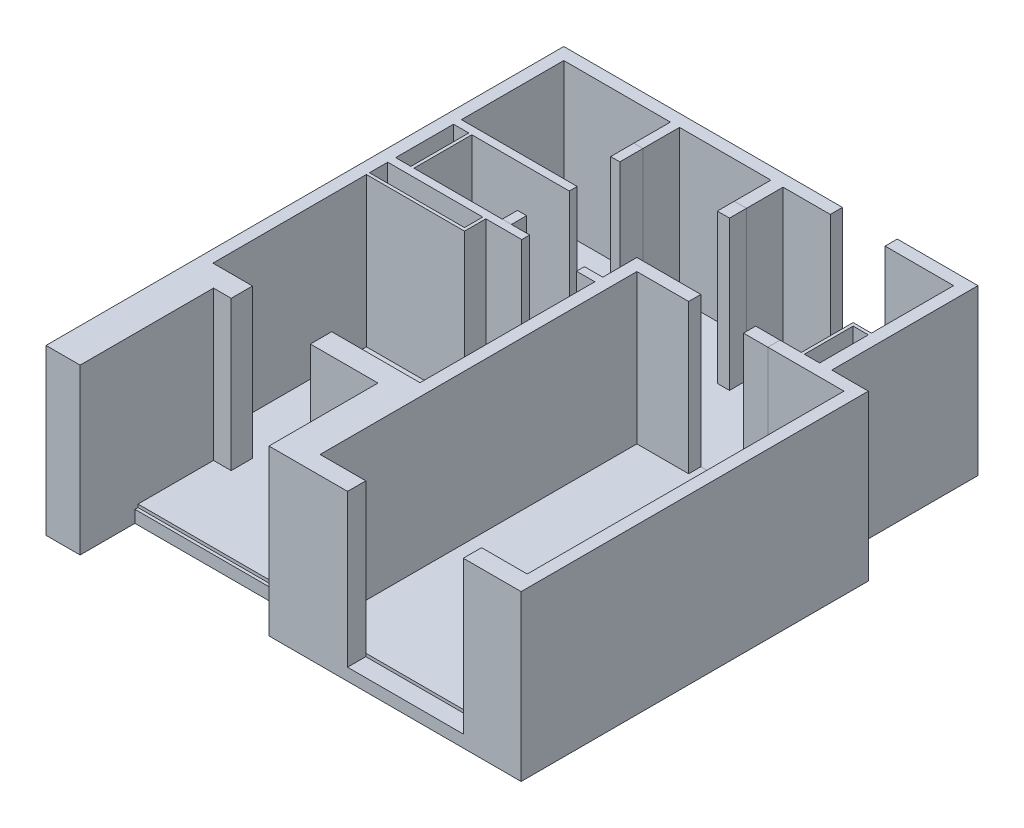
from build123d import *

# Parameters (mm, degrees)
EXTRUDE_2786_DEPTH     = 2500
EXTRUDE_2786_2_DEPTH   = 2500
EXTRUDE_2786_3_DEPTH   = 2500
SKETCH_5_W             = 2200
SKETCH_5_H             = 130
SKETCH_5_W_2           = 300
SKETCH_5_W_3           = 150
SKETCH_5_H_2           = 600
EXTRUDE_3628_DEPTH     = 2500
SKETCH_7_W             = 950
SKETCH_7_H             = 100
EXTRUDE_4552_DEPTH     = 2500
SKETCH_8_W             = 1660
SKETCH_8_H             = 400
SKETCH_8_W_2           = 1560
SKETCH_8_H_2           = 300
EXTRUDE_5124_DEPTH     = 2500
SKETCH_9_W             = 350
SKETCH_9_H             = 900
SKETCH_9_W_2           = 250
SKETCH_9_H_2           = 800
SKETCH_9_H_3           = 1050
SKETCH_9_H_4           = 950
EXTRUDE_5639_DEPTH     = 2500
SKETCH_11_W            = 600
SKETCH_11_H            = 350
EXTRUDE_5921_DEPTH     = 600
EXTRUDE_6398_DEPTH     = 200
SKETCH_13_W            = 150
SKETCH_13_H            = 250
SKETCH_13_H_2          = 380
SKETCH_13_W_2          = 600
SKETCH_13_H_3          = 350
CUT_EXTRUDE_7565_DEPTH = 11480.982578384
SKETCH_14_W            = 400
SKETCH_14_H            = 200
EXTRUDE_7970_DEPTH     = 2500
SKETCH_14_W_2          = 150
SKETCH_14_H_2          = 250
EXTRUDE_7970_2_DEPTH   = 2500
SKETCH_14_H_3          = 380
EXTRUDE_7970_3_DEPTH   = 2500
SKETCH_15_W            = 200
SKETCH_15_H            = 280
EXTRUDE_2_DEPTH        = 2500
EXTRUDE_8866_DEPTH     = 50
EXTRUDE_9266_DEPTH     = 50
EXTRUDE_9553_DEPTH     = 50
EXTRUDE_9789_DEPTH     = 50
SKETCH_45_W            = 80
SKETCH_45_H            = 950
EXTRUDE_33_DEPTH       = 1200
SKETCH_46_W            = 360
SKETCH_46_H            = 360
SKETCH_46_W_2          = 150
SKETCH_46_H_2          = 90
SKETCH_46_W_3          = 200
SKETCH_46_H_3          = 500
CUT_EXTRUDE_2_DEPTH    = 80
EXTRUDE_11227_DEPTH    = 50


with BuildPart() as part:
    # Эскиз3 → Extrude 2786 (new body)
    with BuildSketch(Plane(origin=(0, 0, 0), x_dir=(1, 0, 0), z_dir=(0, 1, 0))):
        Polygon((100, 8300), (3500, 8300), (3500, 7700), (3700, 7700), (3700, 8300), (4475, 8300), (4475, 8500), (-100, 8500), (-100, 0), (100, 0), align=None)
    extrude(amount=EXTRUDE_2786_DEPTH)



with BuildPart() as body_2:
    # Эскиз3 → Extrude 2786 2 (new body)
    with BuildSketch(Plane(origin=(0, 0, 0), x_dir=(1, 0, 0), z_dir=(0, 1, 0))):
        Polygon((6500, 6100), (5850, 6100), (5850, 5900), (7100, 5900), (7100, 700), (6350, 700), (6350, 500), (7300, 500), (7300, 6100), (6700, 6100), (6700, 8500), (5375, 8500), (5375, 8300), (6500, 8300), align=None)
    extrude(amount=EXTRUDE_2786_2_DEPTH)


with BuildPart() as body_3:
    # Эскиз3 → Extrude 2786 3 (new body)
    with BuildSketch(Plane(origin=(0, 0, 0), x_dir=(1, 0, 0), z_dir=(0, 1, 0))):
        Polygon((4450, 700), (3700, 700), (3700, 5900), (4550, 5900), (4550, 6100), (3500, 6100), (3500, 500), (4450, 500), align=None)
    extrude(amount=EXTRUDE_2786_3_DEPTH)


with BuildPart() as part_1:
    add(part.part)

    add(body_3.part)  # Extrude 3628 merges body 3
    # Эскиз5 → Extrude 3628 (add)
    with BuildSketch(Plane(origin=(0, 0, 0), x_dir=(1, 0, 0), z_dir=(0, 1, 0))):
        Polygon((100, 6620), (1850, 6620), (1850, 7000), (2000, 7000), (2000, 6240), (1850, 6240), (1850, 6490), (100, 6490), align=None)
        with Locations((1200, 5475)):
            Rectangle(SKETCH_5_W, SKETCH_5_H)
        with Locations((3350, 5475)):
            Rectangle(SKETCH_5_W_2, SKETCH_5_H)
        with Locations((1925, 8000)):
            Rectangle(SKETCH_5_W_3, SKETCH_5_H_2)
    extrude(amount=EXTRUDE_3628_DEPTH)


    add(body_2.part)  # Extrude 4552 merges body 2
    # Эскиз7 → Extrude 4552 (add)
    with BuildSketch(Plane(origin=(0, 0, 0), x_dir=(1, 0, 0), z_dir=(0, 1, 0))):
        Polygon((750, 2190), (750, 2540), (100, 2540), (100, 0), (460, 0), (460, 2190), align=None)
        Polygon((2050, 2190), (3160, 2190), (3160, 400), (4450, 400), (4450, 500), (3500, 500), (3500, 2540), (2050, 2540), align=None)
        with Locations((6825, 450)):
            Rectangle(SKETCH_7_W, SKETCH_7_H)
    extrude(amount=EXTRUDE_4552_DEPTH)

    # Эскиз8 → Extrude 5124 (add)
    with BuildSketch(Plane(origin=(0, 0, 0), x_dir=(1, 0, 0), z_dir=(0, 1, 0))):
        with Locations((880, 5260)):
            Rectangle(SKETCH_8_W, SKETCH_8_H)
        with Locations((880, 5260)):
            Rectangle(SKETCH_8_W_2, SKETCH_8_H_2, mode=Mode.SUBTRACT)
    extrude(amount=EXTRUDE_5124_DEPTH)

    # Эскиз9 → Extrude 5639 (add)
    # profile 1 of 2: a face of its own
    with BuildSketch(Plane(origin=(0, 0, 0), x_dir=(1, 0, 0), z_dir=(0, 1, 0))):
        with Locations((6375, 6500)):
            Rectangle(SKETCH_9_W, SKETCH_9_H)
        with Locations((6375, 6500)):
            Rectangle(SKETCH_9_W_2, SKETCH_9_H_2, mode=Mode.SUBTRACT)
    # profile 2 of 2: a face of its own
    with BuildSketch(Plane(origin=(0, 0, 0), x_dir=(1, 0, 0), z_dir=(0, 1, 0))):
        with Locations((225, 6015)):
            Rectangle(SKETCH_9_W, SKETCH_9_H_3)
        with Locations((225, 6015)):
            Rectangle(SKETCH_9_W_2, SKETCH_9_H_4, mode=Mode.SUBTRACT)
    extrude(amount=EXTRUDE_5639_DEPTH)

    # Эскиз11 → Extrude 5921 (add)
    with BuildSketch(Plane(origin=(0, 0, 0), x_dir=(1, 0, 0), z_dir=(0, 1, 0))):
        with Locations((1750, 2365)):
            Rectangle(SKETCH_11_W, SKETCH_11_H)
    extrude(amount=EXTRUDE_5921_DEPTH)

    # Эскиз4 → Extrude 6398 (add)
    with BuildSketch(Plane(origin=(0, 0, 0), x_dir=(1, 0, 0), z_dir=(0, 1, 0))):
        Polygon((-100, 8500), (6700, 8500), (6700, 6100), (7300, 6100), (7300, 400), (3160, 400), (3160, 900), (460, 900), (460, 0), (-100, 0), align=None)
    extrude(amount=-EXTRUDE_6398_DEPTH)

    # Эскиз13 → Cut-Extrude 7565 (cut, through all)
    with BuildSketch(Plane(origin=(0, 0, 0), x_dir=(1, 0, 0), z_dir=(0, 1, 0))):
        with Locations((1925, 6365)):
            Rectangle(SKETCH_13_W, SKETCH_13_H)
        with Locations((1925, 6810)):
            Rectangle(SKETCH_13_W, SKETCH_13_H_2)
        with Locations((1750, 2365)):
            Rectangle(SKETCH_13_W_2, SKETCH_13_H_3)
    extrude(amount=CUT_EXTRUDE_7565_DEPTH, mode=Mode.SUBTRACT)


with BuildPart() as body_2_2:
    # Эскиз14 → Extrude 7970 (new, through all)
    with BuildSketch(Plane(origin=(0, 0, 0), x_dir=(1, 0, 0), z_dir=(0, 1, 0))):
        with Locations((5650, 6000)):
            Rectangle(SKETCH_14_W, SKETCH_14_H)
    extrude(amount=EXTRUDE_7970_DEPTH)


with BuildPart() as body_3_2:
    # Эскиз14 → Extrude 7970 2 (new, through all)
    with BuildSketch(Plane(origin=(0, 0, 0), x_dir=(1, 0, 0), z_dir=(0, 1, 0))):
        with Locations((1925, 5665)):
            Rectangle(SKETCH_14_W_2, SKETCH_14_H_2)
    extrude(amount=EXTRUDE_7970_2_DEPTH)


with BuildPart() as body_4:
    # Эскиз14 → Extrude 7970 3 (new, through all)
    with BuildSketch(Plane(origin=(0, 0, 0), x_dir=(1, 0, 0), z_dir=(0, 1, 0))):
        with Locations((1925, 7510)):
            Rectangle(SKETCH_14_W_2, SKETCH_14_H_3)
    extrude(amount=EXTRUDE_7970_3_DEPTH)


with BuildPart() as body_5:
    # Эскиз15 → наращивание стен 2 (new, through all)
    with BuildSketch(Plane(origin=(0, 0, 0), x_dir=(1, 0, 0), z_dir=(0, 1, 0))):
        with Locations((3600, 7560)):
            Rectangle(SKETCH_15_W, SKETCH_15_H)
    extrude(amount=EXTRUDE_2_DEPTH)


with BuildPart() as body_6:
    # Эскиз37 → Extrude 8866 (new body)
    with BuildSketch(Plane(origin=(0, 0, 0), x_dir=(1, 0, 0), z_dir=(0, 1, 0))):
        Polygon((3700, 700), (7100, 700), (7100, 5900), (5850, 5900), (5850, 6100), (4550, 6100), (4550, 5900), (3700, 5900), align=None)
    extrude(amount=EXTRUDE_8866_DEPTH)


with BuildPart() as body_7:
    # Эскиз38 → Extrude 9266 (new body)
    with BuildSketch(Plane(origin=(0, 0, 0), x_dir=(1, 0, 0), z_dir=(0, 1, 0))):
        Polygon((460, 950), (3160, 950), (3160, 2190), (2050, 2190), (2050, 2540), (3500, 2540), (3500, 5410), (3200, 5410), (3200, 5540), (2300, 5540), (2300, 5410), (1710, 5410), (1710, 5060), (100, 5060), (100, 2540), (750, 2540), (750, 2190), (460, 2190), align=None)
    extrude(amount=EXTRUDE_9266_DEPTH)


with BuildPart() as body_8:
    # Эскиз40 → Extrude 9553 (new body)
    with BuildSketch(Plane(origin=(0, 0, 0), x_dir=(1, 0, 0), z_dir=(0, 1, 0))):
        Polygon((6200, 6100), (6200, 6950), (6500, 6950), (6500, 8300), (3700, 8300), (3700, 7420), (3500, 7420), (3500, 8300), (2000, 8300), (2000, 5540), (3500, 5540), (3500, 6100), align=None)
    extrude(amount=EXTRUDE_9553_DEPTH)


with BuildPart() as body_9:
    # Эскиз42 → Extrude 9789 (new body)
    with BuildSketch(Plane(origin=(0, 0, 0), x_dir=(1, 0, 0), z_dir=(0, 1, 0))):
        Polygon((100, 8300), (100, 6620), (2000, 6620), (2000, 7320), (1850, 7320), (1850, 8300), align=None)
    extrude(amount=EXTRUDE_9789_DEPTH)


with BuildPart() as body_10:
    # Эскиз45 → Бобышка-Вытянуть33 (new body)
    with BuildSketch(Plane(origin=(0, 50, 0), x_dir=(1, 0, 0), z_dir=(0, 1, 0))):
        with Locations((890, 6015)):
            Rectangle(SKETCH_45_W, SKETCH_45_H)
    extrude(amount=EXTRUDE_33_DEPTH)

    # Эскиз46 → Вырез-Вытянуть2 (cut)
    with BuildSketch(Plane(origin=(930, 0, 0), x_dir=(0, 0, -1), z_dir=(1, 0, 0))):
        with Locations((6015, 260)):
            Rectangle(SKETCH_46_W, SKETCH_46_H)
        with Locations((6015, 995)):
            Rectangle(SKETCH_46_W_2, SKETCH_46_H_2)
        with Locations((6380, 300)):
            Rectangle(SKETCH_46_W_3, SKETCH_46_H_3)
    extrude(amount=-CUT_EXTRUDE_2_DEPTH, mode=Mode.SUBTRACT)


with BuildPart() as body_11:
    # Эскиз43 → Extrude 11227 (new body)
    with BuildSketch(Plane(origin=(0, 0, 0), x_dir=(1, 0, 0), z_dir=(0, 1, 0))):
        Polygon((930, 6490), (930, 5540), (1850, 5540), (1850, 5790), (2000, 5790), (2000, 6490), align=None)
    extrude(amount=EXTRUDE_11227_DEPTH)


solid = Compound([part_1.part, body_2_2.part, body_3_2.part, body_4.part, body_5.part, body_6.part, body_7.part, body_8.part, body_9.part, body_10.part, body_11.part])
